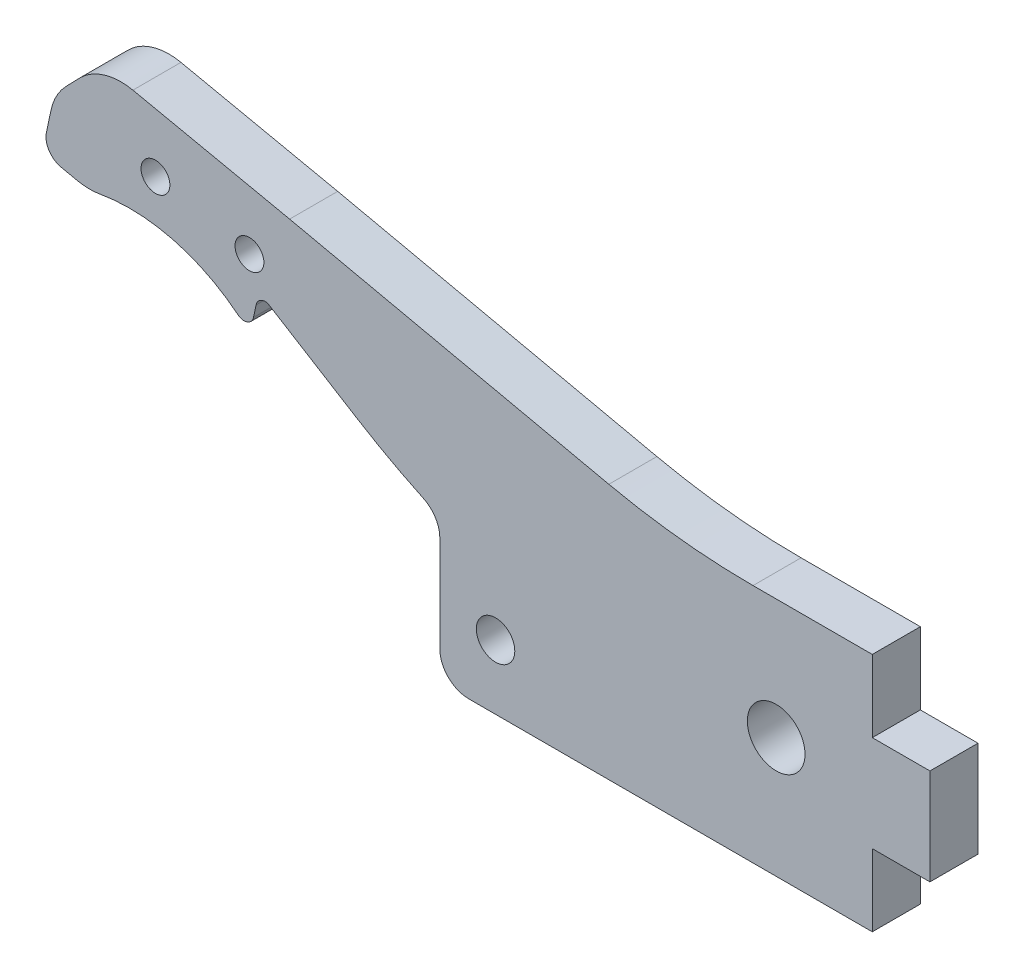
from build123d import *

# Parameters (mm, degrees)
SKETCH1_R           = 3
SKETCH1_R_2         = 2
SKETCH1_R_3         = 1.5
BOSS_EXTRUDE1_DEPTH = 5


with BuildPart() as part:
    # Sketch1 → Boss-Extrude1 (new body)
    with BuildSketch(Plane.XY):
        with BuildLine():
            Line((7.589765397, 12.5), (20, 12.5))
            Line((20, 12.5), (20, 5))
            Line((20, 5), (26, 5))
            Line((26, 5), (26, -5))
            Line((26, -5), (20, -5))
            Line((20, -5), (20, -12.5))
            Line((20, -12.5), (0, -12.5))
            Line((0, -12.5), (-22, -12.5))
            ThreePointArc((-22, -12.5), (-24.121320344, -11.621320344), (-25, -9.5))
            Line((-25, -9.5), (-25, 0.5))
            ThreePointArc((-25, 0.5), (-25.465496735, 2.105083549), (-26.717528799, 3.212059663))
            ThreePointArc((-26.717528799, 3.212059663), (-30.169638016, 4.962862371), (-33.519694565, 6.901802618))
            Line((-33.519694565, 6.901802618), (-42.934572397, 12.704217168))
            ThreePointArc((-42.934572397, 12.704217168), (-43.687123123, 12.564740135), (-44.120631689, 11.933981258))
            Line((-44.120631689, 11.933981258), (-44.388558942, 10.673482635))
            ThreePointArc((-44.388558942, 10.673482635), (-45.031133401, 9.939380171), (-45.993109182, 10.101894657))
            ThreePointArc((-45.993109182, 10.101894657), (-52.796527237, 13.506575009), (-60.398778904, 13.796601081))
            ThreePointArc((-60.398778904, 13.796601081), (-61.546162789, 13.706067739), (-62.68972312, 13.836282296))
            Line((-62.68972312, 13.836282296), (-64.396986027, 14.199172229))
            ThreePointArc((-64.396986027, 14.199172229), (-65.658503782, 15.066189361), (-65.937457847, 16.571290812))
            Line((-65.937457847, 16.571290812), (-65.463517392, 18.801005349))
            ThreePointArc((-65.463517392, 18.801005349), (-64.892317345, 20.370364581), (-63.91067059, 21.721485427))
            Line((-63.91067059, 21.721485427), (-62.501386729, 23.180841584))
            ThreePointArc((-62.501386729, 23.180841584), (-59.939578156, 24.750719897), (-56.937877783, 24.881776966))
            Line((-56.937877783, 24.881776966), (-40.62810218, 21.415027142))
            Line((-40.62810218, 21.415027142), (-7.413387902, 14.126720197))
            ThreePointArc((-7.413387902, 14.126720197), (0.044223211, 12.90786831), (7.589765397, 12.5))
        make_face()
        with Locations((10, 0)):
            Circle(SKETCH1_R, mode=Mode.SUBTRACT)
        with Locations((-19.2, -5.8)):
            Circle(SKETCH1_R_2, mode=Mode.SUBTRACT)
        with Locations((-54.590724376, 18.248830539)):
            Circle(SKETCH1_R_3, mode=Mode.SUBTRACT)
        with Locations((-44.809248369, 16.169713631)):
            Circle(SKETCH1_R_3, mode=Mode.SUBTRACT)
    extrude(amount=BOSS_EXTRUDE1_DEPTH)


solid = part.part
